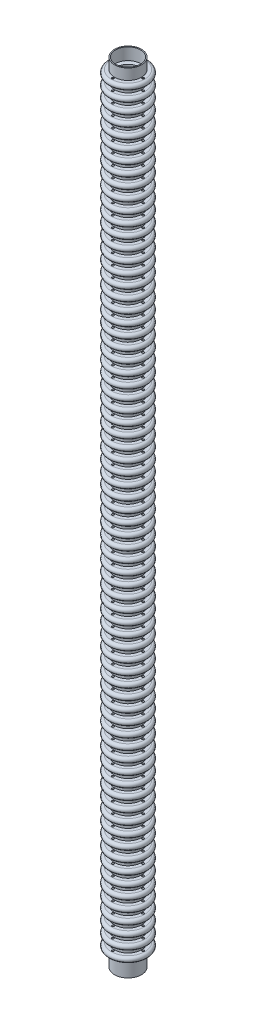
from build123d import *

# Parameters (mm, degrees)
SKETCH3_R           = 125
BOSS_EXTRUDE1_DEPTH = 7300
SHELL1_T            = -10
SKETCH11_R          = 10
CUT_EXTRUDE1_DEPTH  = 7205.498594633
LPATTERN2_COUNT     = 71
LPATTERN2_PITCH     = 100


with BuildPart() as part:
    # Sketch3 → Boss-Extrude1 (new body)
    with BuildSketch(Plane(origin=(0, 0, 0), x_dir=(1, 0, 0), z_dir=(0, 1, 0))):
        with Locations(Location((0, 0, 0), (0, 0, 270))):
            Circle(SKETCH3_R)
    extrude(amount=-BOSS_EXTRUDE1_DEPTH)

    # Sketch9 → Revolve1 (revolve)
    with BuildSketch(Plane.XY, mode=Mode.PRIVATE) as revolve1_sk:
        with BuildLine():
            Line((125, -100), (155, -100))
            ThreePointArc((155, -100), (180, -125), (155, -150))
            Line((155, -150), (125, -150))
            Line((125, -150), (125, -100))
        make_face()
    revolve1 = revolve(revolve1_sk.sketch.rotate(Axis((0, -7300, 0), (0, 1, 0)), 270), axis=Axis((0, -7300, 0), (0, 1, 0)))

    # Shell1
    shell1_openings = [part.faces().sort_by_distance(p)[0] for p in [
        (0, 0, 0),
    ]]
    offset(amount=SHELL1_T, openings=shell1_openings, kind=Kind.INTERSECTION)

    # Sketch11 → Cut-Extrude1 (cut, through all)
    with BuildSketch(Plane(origin=(0, -100, 0), x_dir=(1, 0, 0), z_dir=(0, 1, 0))):
        with Locations(Location((0, 140, 0), (0, 0, 90))):
            Circle(SKETCH11_R)
        with Locations(Location((-140, 0, 0), (0, 0, 90))):
            Circle(SKETCH11_R)
    cut_extrude1 = extrude(amount=-CUT_EXTRUDE1_DEPTH, mode=Mode.SUBTRACT)

    # LPattern2: Revolve1 ×71
    with Locations(*[(0, -i * LPATTERN2_PITCH, 0) for i in range(1, LPATTERN2_COUNT)]):
        add(revolve1)

    # Mirror2: Cut-Extrude1 across plane
    add(cut_extrude1.mirror(Plane(origin=(0, 0, 0), x_dir=(0, 0, 1), z_dir=(1, 0, 0))), mode=Mode.SUBTRACT)

    # Mirror2 at the second plane: Cut-Extrude1 across plane
    add(cut_extrude1.mirror(Plane.XY), mode=Mode.SUBTRACT)


solid = part.part
